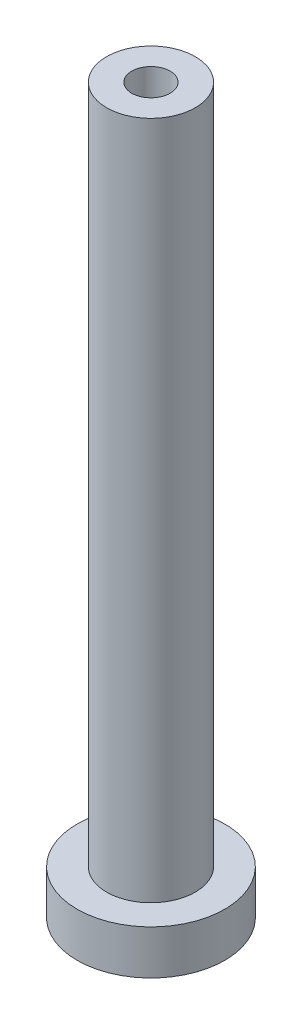
from build123d import *


with BuildPart() as part:
    # 草图1 → 旋转1 (revolve)
    with BuildSketch(Plane(origin=(0, 0, 0), x_dir=(0, 0, -1), z_dir=(1, 0, 0))):
        Polygon((0, 0), (0, 1.5), (1, 1.5), (1, 24.5), (1.85, 24.5), (1.85, 16.5), (2.5, 16.5), (2.5, 0), align=None)
    revolve(axis=Axis((0, 16.5, -2.5), (0, -1, 0)))


solid = part.part
